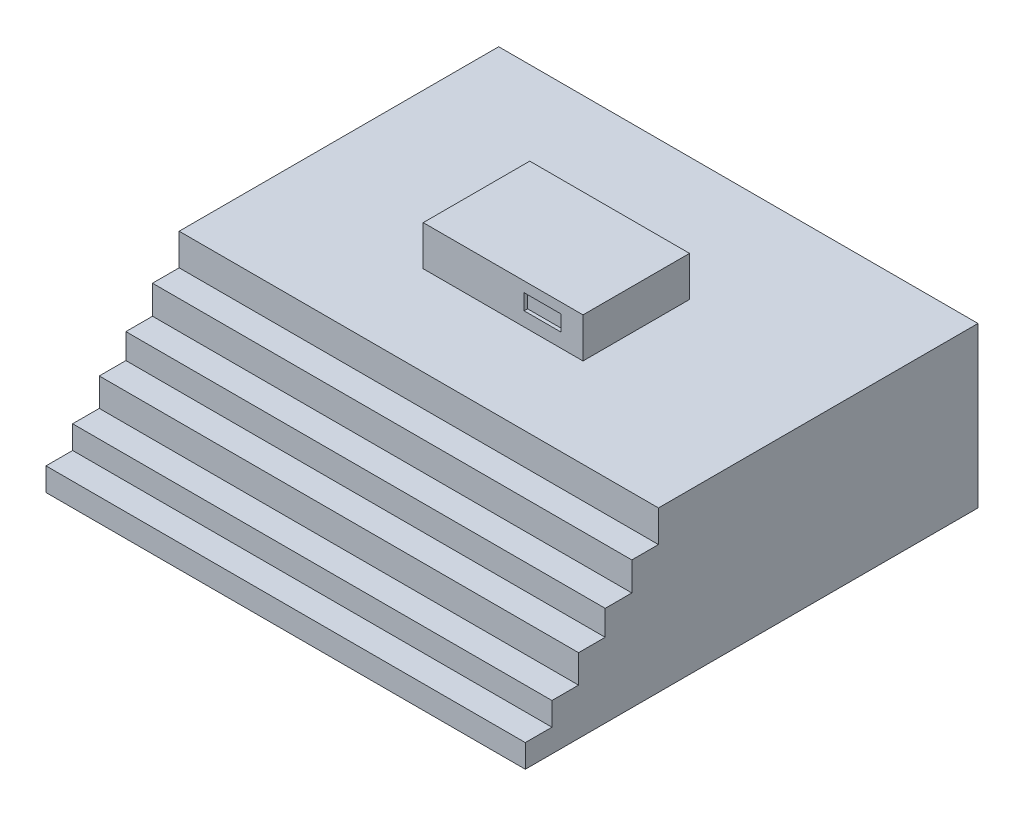
from build123d import *

# Parameters (mm, degrees)
SKETCH2_W           = 914.4
SKETCH2_H           = 304.8
BOSS_EXTRUDE3_DEPTH = 609.6
SKETCH3_W           = 914.4
SKETCH3_H           = 244.302361722
BOSS_EXTRUDE4_DEPTH = 50.8
SKETCH4_W           = 914.4
SKETCH4_H           = 189.735334449
BOSS_EXTRUDE5_DEPTH = 50.8
SKETCH5_W           = 914.4
SKETCH5_H           = 141.869521053
BOSS_EXTRUDE6_DEPTH = 50.8
SKETCH6_W           = 914.4
SKETCH6_H           = 88.259810048
BOSS_EXTRUDE7_DEPTH = 50.8
SKETCH7_W           = 914.4
SKETCH7_H           = 44.129905024
BOSS_EXTRUDE8_DEPTH = 50.8
SKETCH8_W           = 304.8
SKETCH8_H           = 203.2
BOSS_EXTRUDE9_DEPTH = 76.2
SKETCH9_W           = 70
SKETCH9_H           = 30
CUT_EXTRUDE1_DEPTH  = 6.604


with BuildPart() as part:
    # Sketch2 → Boss-Extrude3 (new body)
    with BuildSketch(Plane.XY):
        with Locations((314.492107476, 633.364976232)):
            Rectangle(SKETCH2_W, SKETCH2_H)
    extrude(amount=BOSS_EXTRUDE3_DEPTH)

    # Sketch3 → Boss-Extrude4 (add)
    with BuildSketch(Plane.XY.offset(609.6)):
        with Locations((314.492107476, 603.116157093)):
            Rectangle(SKETCH3_W, SKETCH3_H)
    extrude(amount=BOSS_EXTRUDE4_DEPTH)

    # Sketch4 → Boss-Extrude5 (add)
    with BuildSketch(Plane.XY.offset(660.4)):
        with Locations((314.492107476, 575.832643457)):
            Rectangle(SKETCH4_W, SKETCH4_H)
    extrude(amount=BOSS_EXTRUDE5_DEPTH)

    # Sketch5 → Boss-Extrude6 (add)
    with BuildSketch(Plane.XY.offset(711.2)):
        with Locations((314.492107476, 551.899736759)):
            Rectangle(SKETCH5_W, SKETCH5_H)
    extrude(amount=BOSS_EXTRUDE6_DEPTH)

    # Sketch6 → Boss-Extrude7 (add)
    with BuildSketch(Plane.XY.offset(762)):
        with Locations((314.492107476, 525.094881256)):
            Rectangle(SKETCH6_W, SKETCH6_H)
    extrude(amount=BOSS_EXTRUDE7_DEPTH)

    # Sketch7 → Boss-Extrude8 (add)
    with BuildSketch(Plane.XY.offset(812.8)):
        with Locations((314.492107476, 503.029928744)):
            Rectangle(SKETCH7_W, SKETCH7_H)
    extrude(amount=BOSS_EXTRUDE8_DEPTH)

    # Sketch8 → Boss-Extrude9 (add)
    with BuildSketch(Plane(origin=(0, 785.764976232, 0), x_dir=(1, 0, 0), z_dir=(0, 1, 0))):
        with Locations((304.540679121, -337.195909304)):
            Rectangle(SKETCH8_W, SKETCH8_H)
    extrude(amount=BOSS_EXTRUDE9_DEPTH)

    # Sketch9 → Cut-Extrude1 (cut)
    with BuildSketch(Plane.XY.offset(438.795909304)):
        with Locations((379.707122213, 827.488030004)):
            Rectangle(SKETCH9_W, SKETCH9_H)
    extrude(amount=-CUT_EXTRUDE1_DEPTH, mode=Mode.SUBTRACT)


solid = part.part
